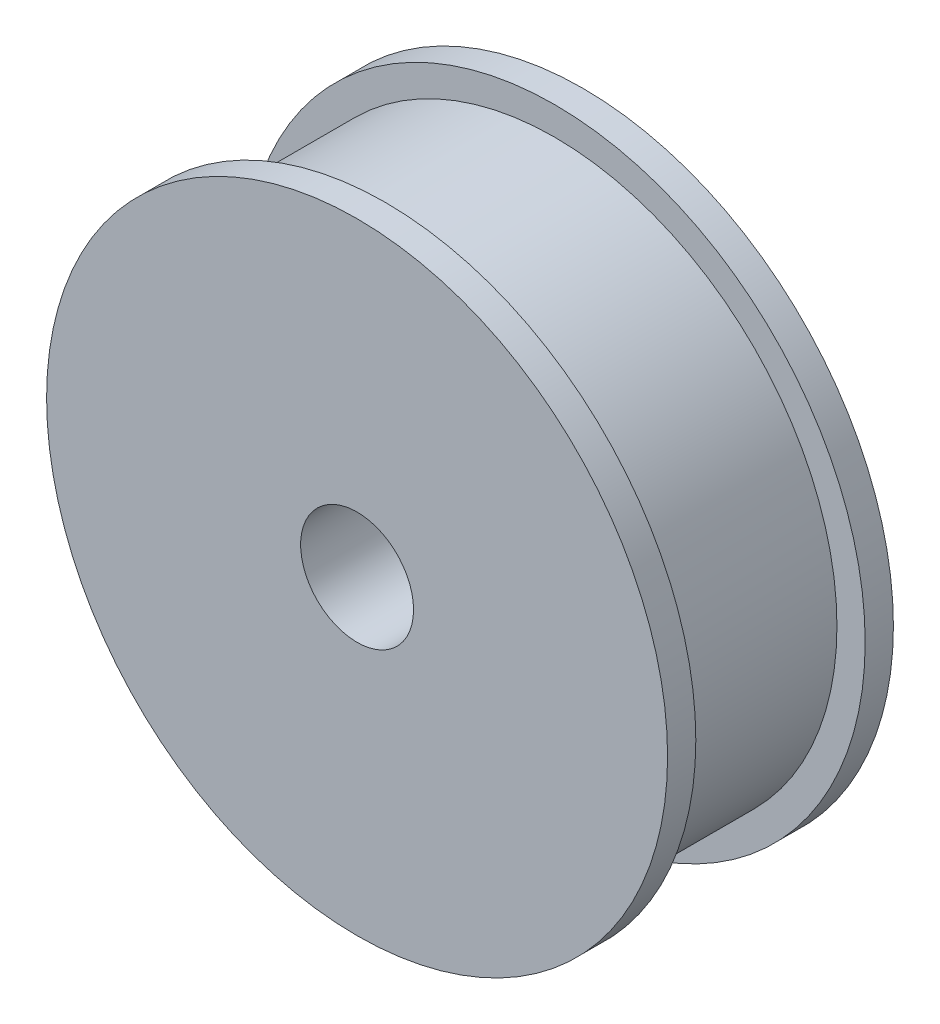
from build123d import *

# Parameters (mm, degrees)
SKETCH_1_R               = 16.5
EXTRUDE_1_DEPTH          = 12
CUT_EXTRUDE_1_DEPTH      = 4.5
CUT_EXTRUDE_1_DEPTH_BACK = 4.5
SKETCH_2_R               = 19.5
SKETCH_2_R_2             = 15
SKETCH_3_R               = 3
CUT_EXTRUDE_2_DEPTH      = 27.239283527


with BuildPart() as part:
    # 草图1 → 凸台-拉伸1 (new body)
    with BuildSketch(Plane.XY):
        Circle(SKETCH_1_R)
    extrude(amount=EXTRUDE_1_DEPTH)

    # 草图2 → 切除-拉伸1 (cut, two sides: drawn at the far end of the back side and taken through both)
    with BuildSketch(Plane.XY.offset(6).offset(-CUT_EXTRUDE_1_DEPTH_BACK)):
        Circle(SKETCH_2_R)
        Circle(SKETCH_2_R_2, mode=Mode.SUBTRACT)
    extrude(amount=CUT_EXTRUDE_1_DEPTH + CUT_EXTRUDE_1_DEPTH_BACK, mode=Mode.SUBTRACT)

    # 草图3 → 切除-拉伸2 (cut, through all)
    with BuildSketch(Plane.XY.offset(12)):
        Circle(SKETCH_3_R)
    extrude(amount=-CUT_EXTRUDE_2_DEPTH, mode=Mode.SUBTRACT)


solid = part.part
